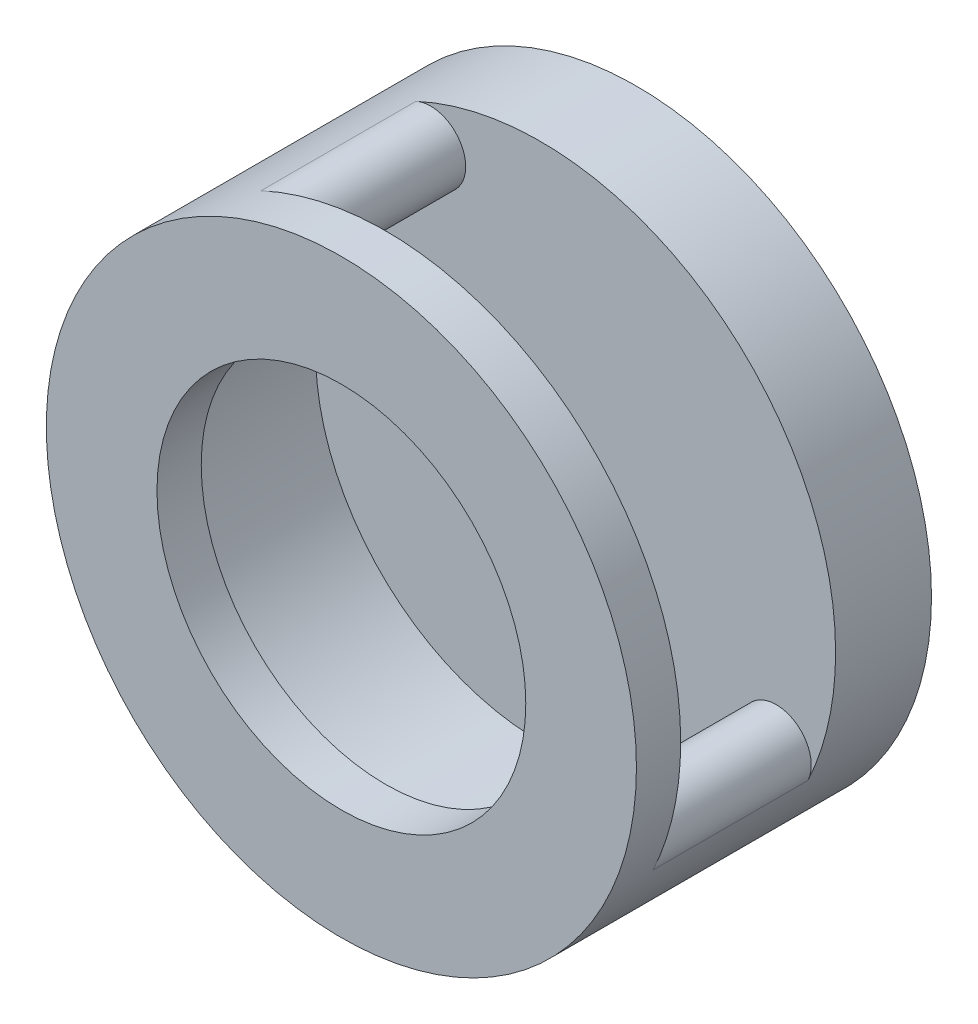
from build123d import *

# Parameters (mm, degrees)
SKETCH_1_R          = 4
EXTRUDE_1_DEPTH     = 4
SKETCH_2_R          = 2.5
CUT_EXTRUDE_1_DEPTH = 0.6
CUT_EXTRUDE_2_DEPTH = 2.1


with BuildPart() as part:
    # 草图1 → 凸台-拉伸1 (new body)
    with BuildSketch(Plane.XY):
        Circle(SKETCH_1_R)
    extrude(amount=EXTRUDE_1_DEPTH)

    # 草图2 → 切除-拉伸1 (cut)
    with BuildSketch(Plane.XY.offset(4)):
        Circle(SKETCH_2_R)
    extrude(amount=-CUT_EXTRUDE_1_DEPTH, mode=Mode.SUBTRACT)

    # 草图3 → 切除-拉伸2 (cut)
    with BuildSketch(Plane.XY.offset(3.4)):
        with BuildLine():
            Line((-1.690473047, 3.625231148), (-2.113091309, 4.531538935))
            ThreePointArc((-2.113091309, 4.531538935), (3.535533906, 3.535533906), (4.531538935, -2.113091309))
            Line((4.531538935, -2.113091309), (3.625231148, -1.690473047))
            ThreePointArc((3.625231148, -1.690473047), (3.395478624, -1.059233174), (2.76423875, -1.288985698))
            ThreePointArc((2.76423875, -1.288985698), (-2.156675683, -2.156675683), (-1.288985698, 2.76423875))
            ThreePointArc((-1.288985698, 2.76423875), (-1.059233174, 3.395478624), (-1.690473047, 3.625231148))
        make_face()
    extrude(amount=-CUT_EXTRUDE_2_DEPTH, mode=Mode.SUBTRACT)


solid = part.part
